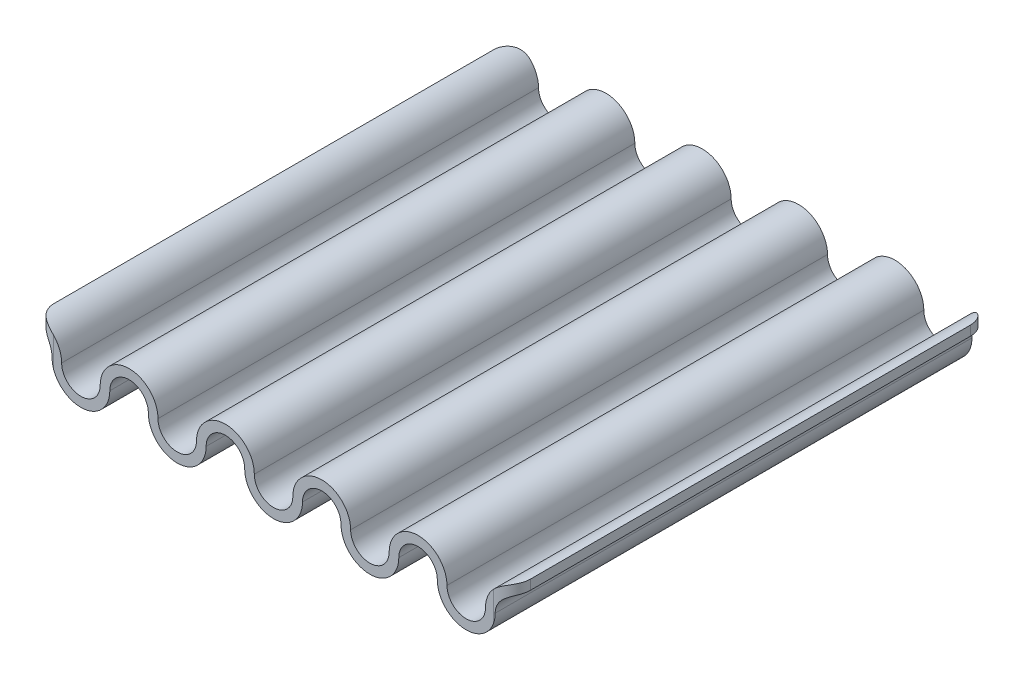
from build123d import *

# Parameters (mm, degrees)
BOSS_EXTRUDE3_DEPTH = 51.43
CUT_EXTRUDE1_DEPTH  = 10


with BuildPart() as part:
    # Sketch2 → Boss-Extrude3 (new body)
    with BuildSketch(Plane.XY):
        with BuildLine():
            ThreePointArc((44.414999988, 3.116666665), (43.502149457, 5.320482799), (41.298333323, 6.23333333))
            ThreePointArc((41.298333323, 6.23333333), (39.09451719, 5.320482799), (38.181666658, 3.116666665))
            ThreePointArc((38.181666658, 3.116666665), (36.103888882, 1.038888889), (34.026111106, 3.116666665))
            ThreePointArc((34.026111106, 3.116666665), (33.113260575, 5.320482799), (30.909444441, 6.23333333))
            ThreePointArc((30.909444441, 6.23333333), (28.705628308, 5.320482799), (27.792777776, 3.116666665))
            ThreePointArc((27.792777776, 3.116666665), (25.715, 1.038888889), (23.637222224, 3.116666665))
            ThreePointArc((23.637222224, 3.116666665), (22.724371692, 5.320482799), (20.520555559, 6.23333333))
            ThreePointArc((20.520555559, 6.23333333), (18.316739425, 5.320482799), (17.403888894, 3.116666665))
            ThreePointArc((17.403888894, 3.116666665), (15.326111118, 1.038888889), (13.248333342, 3.116666665))
            ThreePointArc((13.248333342, 3.116666665), (12.33548281, 5.320482799), (10.131666677, 6.23333333))
            ThreePointArc((10.131666677, 6.23333333), (7.927850543, 5.320482799), (7.015000012, 3.116666665))
            ThreePointArc((7.015000012, 3.116666665), (4.937222236, 1.038888889), (2.859444459, 3.116666665))
            ThreePointArc((2.859444459, 3.116666665), (2.035732981, 5.227582962), (0, 6.222700766))
            Line((0, 6.222700766), (0, 5.178461326))
            ThreePointArc((0, 5.178461326), (1.300277565, 4.491932077), (1.820555571, 3.116666665))
            ThreePointArc((1.820555571, 3.116666665), (2.733406114, 0.91285052), (4.937222268, 0))
            ThreePointArc((4.937222268, 0), (7.141038381, 0.912850543), (8.053888901, 3.116666665))
            ThreePointArc((8.053888901, 3.116666665), (10.131666677, 5.194444441), (12.209444453, 3.116666665))
            ThreePointArc((12.209444453, 3.116666665), (13.122294999, 0.912850517), (15.326111158, 0))
            ThreePointArc((15.326111158, 0), (17.529927266, 0.912850546), (18.442777783, 3.116666665))
            ThreePointArc((18.442777783, 3.116666665), (20.520555559, 5.194444441), (22.598333335, 3.116666665))
            ThreePointArc((22.598333335, 3.116666665), (23.511183872, 0.912850526), (25.715000016, 0))
            ThreePointArc((25.715000016, 0), (27.918816139, 0.912850537), (28.831666665, 3.116666665))
            ThreePointArc((28.831666665, 3.116666665), (30.909444441, 5.194444441), (32.987222217, 3.116666665))
            ThreePointArc((32.987222217, 3.116666665), (33.900072749, 0.912850531), (36.103888882, 0))
            ThreePointArc((36.103888882, 0), (38.307705016, 0.912850531), (39.220555547, 3.116666665))
            ThreePointArc((39.220555547, 3.116666665), (41.298333323, 5.194444441), (43.376111099, 3.116666665))
            ThreePointArc((43.376111099, 3.116666665), (44.288961637, 0.912850526), (46.492777781, 0))
            ThreePointArc((46.492777781, 0), (48.696593904, 0.912850537), (49.609444429, 3.116666665))
            ThreePointArc((49.609444429, 3.116666665), (50.129722435, 4.491932077), (51.43, 5.178461326))
            Line((51.43, 5.178461326), (51.43, 6.222700766))
            ThreePointArc((51.43, 6.222700766), (49.394267019, 5.227582962), (48.570555541, 3.116666665))
            ThreePointArc((48.570555541, 3.116666665), (46.492777764, 1.038888889), (44.414999988, 3.116666665))
        make_face()
    extrude(amount=BOSS_EXTRUDE3_DEPTH)

    # Sketch3 → Cut-Extrude1 (cut)
    with BuildSketch(Plane(origin=(0, 6.23333333, 0), x_dir=(1, 0, 0), z_dir=(0, 1, 0))):
        with BuildLine():
            Line((51.43, -49.43), (51.43, -51.43))
            Line((51.43, -51.43), (49.43, -51.43))
            ThreePointArc((49.43, -51.43), (50.844213562, -50.844213562), (51.43, -49.43))
        make_face()
        with BuildLine():
            Line((51.43, 0), (49.43, 0))
            ThreePointArc((49.43, 0), (50.844213562, -0.585786438), (51.43, -2))
            Line((51.43, -2), (51.43, 0))
        make_face()
        with BuildLine():
            Line((0, 0), (0, -2))
            ThreePointArc((0, -2), (0.585786438, -0.585786438), (2, 0))
            Line((2, 0), (0, 0))
        make_face()
        with BuildLine():
            Line((0, -49.43), (0, -51.43))
            Line((0, -51.43), (2, -51.43))
            ThreePointArc((2, -51.43), (0.585786438, -50.844213562), (0, -49.43))
        make_face()
    extrude(amount=-CUT_EXTRUDE1_DEPTH, mode=Mode.SUBTRACT)


solid = part.part
